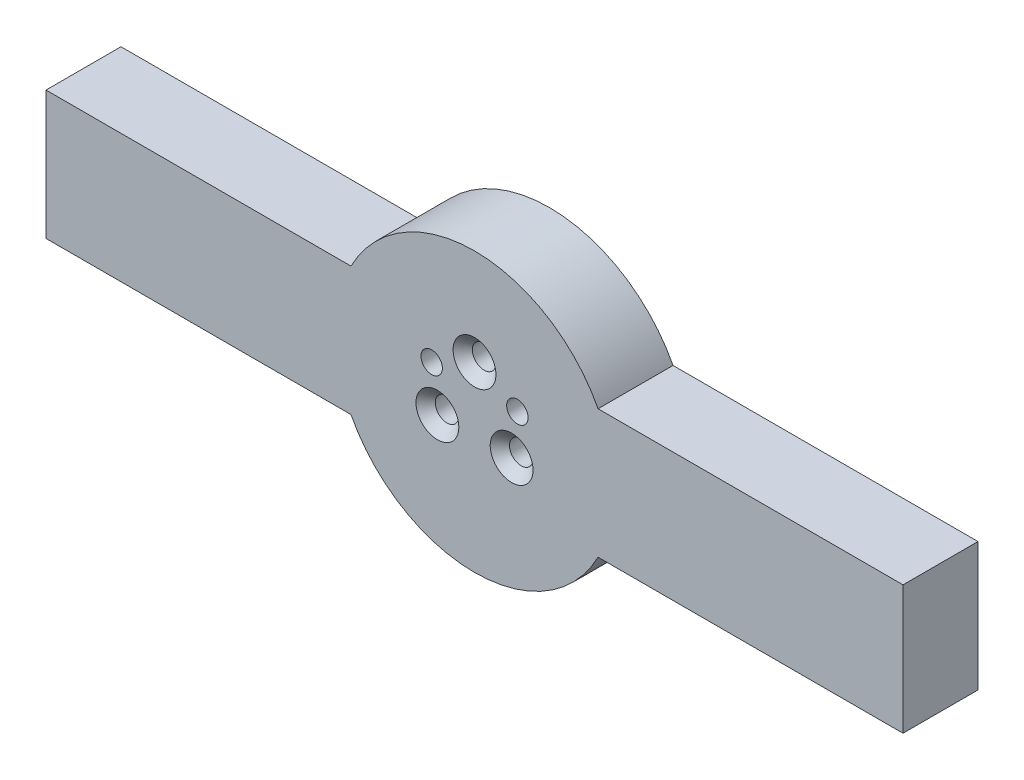
from build123d import *

# Parameters (mm, degrees)
RESSALTO_EXTRUS_O1_DEPTH                             = 35
ESBO_O3_R                                            = 35
CORTE_EXTRUS_O2_DEPTH                                = 15
ESCAREADO_PARA_PARAFUSO_COM_CABE_A_ESCAR_D           = 11
ESCAREADO_PARA_PARAFUSO_COM_CABE_A_ESCAR_CSINK_D     = 20
ESCAREADO_PARA_PARAFUSO_COM_CABE_A_ESCAR_CSINK_ANGLE = 90
FUROS_GUIA_COM_10_0MM1_D                             = 10
ESBO_O2_R                                            = 35
CORTE_EXTRUS_O1_DEPTH                                = 15


with BuildPart() as part:
    # Esboço1 → Ressalto-extrusão1 (new body)
    with BuildSketch(Plane.XY):
        with BuildLine():
            Line((-200, -270), (-57.662812973, -270))
            ThreePointArc((-57.662812973, -270), (0, -305), (57.662812973, -270))
            Line((57.662812973, -270), (200, -270))
            Line((200, -270), (200, -210))
            Line((200, -210), (57.662812973, -210))
            ThreePointArc((57.662812973, -210), (0, -175), (-57.662812973, -210))
            Line((-57.662812973, -210), (-200, -210))
            Line((-200, -210), (-200, -270))
        make_face()
    extrude(amount=RESSALTO_EXTRUS_O1_DEPTH)

    # Esboço3 → Corte-extrusão2 (cut)
    with BuildSketch(Plane(origin=(0, 0, 0), x_dir=(-1, 0, 0), z_dir=(0, 0, -1))):
        with Locations((0, -240)):
            Circle(ESBO_O3_R)
    extrude(amount=-CORTE_EXTRUS_O2_DEPTH, mode=Mode.SUBTRACT)

    # Escareado para parafuso com cabeça escareada elevada de M101 (through all)
    with Locations(Plane.XY.offset(35)):
        with Locations((0, -220), (-17.320508076, -250), (17.320508076, -250)):
            CounterSinkHole(ESCAREADO_PARA_PARAFUSO_COM_CABE_A_ESCAR_D / 2, ESCAREADO_PARA_PARAFUSO_COM_CABE_A_ESCAR_CSINK_D / 2, counter_sink_angle=ESCAREADO_PARA_PARAFUSO_COM_CABE_A_ESCAR_CSINK_ANGLE)

    # Furos-guia com Ø10.0mm1 (through all)
    with Locations(Plane.XY.offset(35)):
        with Locations((-20, -230), (20, -230)):
            Hole(FUROS_GUIA_COM_10_0MM1_D / 2)

    # Esboço2 → Corte-extrusão1 (cut)
    with BuildSketch(Plane(origin=(0, 0, 0), x_dir=(-1, 0, 0), z_dir=(0, 0, -1))):
        with Locations((0, -240)):
            Circle(ESBO_O2_R)
    extrude(amount=-CORTE_EXTRUS_O1_DEPTH, mode=Mode.SUBTRACT)


solid = part.part
